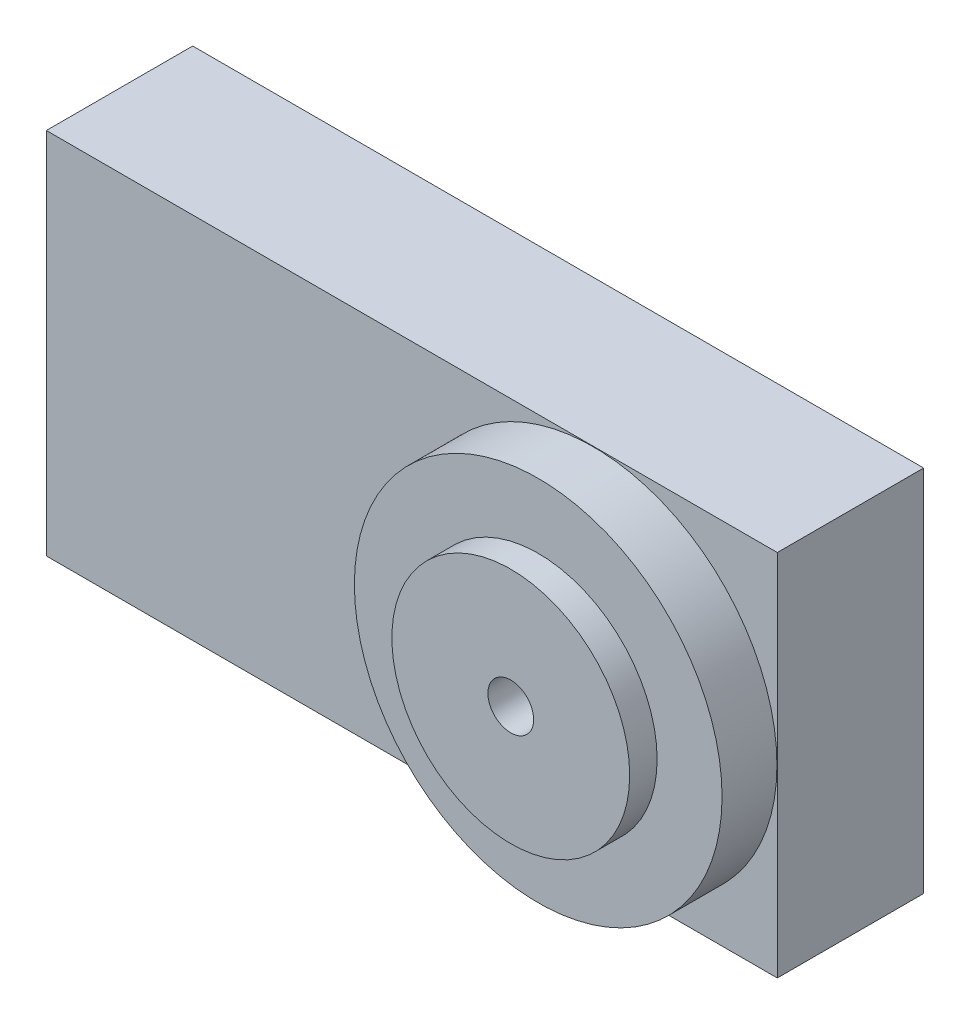
from build123d import *

# Parameters (mm, degrees)
SKETCH1_W           = 39.958127878
SKETCH1_H           = 20.143584626
BOSS_EXTRUDE1_DEPTH = 8
SKETCH2_R           = 10.049780621
BOSS_EXTRUDE2_DEPTH = 3
SKETCH3_R           = 6.5
BOSS_EXTRUDE3_DEPTH = 1.5
SKETCH4_R           = 1.25
CUT_EXTRUDE1_DEPTH  = 5


with BuildPart() as part:
    # Sketch1 → Boss-Extrude1 (new body)
    with BuildSketch(Plane.XY):
        with Locations((25.688484617, -116.024886289)):
            Rectangle(SKETCH1_W, SKETCH1_H)
    extrude(amount=BOSS_EXTRUDE1_DEPTH)

    # Sketch2 → Boss-Extrude2 (add)
    with BuildSketch(Plane.XY.offset(8)):
        with Locations((35.597548556, -116.024886289)):
            Circle(SKETCH2_R)
    extrude(amount=BOSS_EXTRUDE2_DEPTH)

    # Sketch3 → Boss-Extrude3 (add)
    with BuildSketch(Plane.XY.offset(11)):
        with Locations((35.597548556, -116.024886289)):
            Circle(SKETCH3_R)
    extrude(amount=BOSS_EXTRUDE3_DEPTH)

    # Sketch4 → Cut-Extrude1 (cut)
    with BuildSketch(Plane.XY.offset(12.5)):
        with Locations((35.597548556, -116.024886289)):
            Circle(SKETCH4_R)
    extrude(amount=-CUT_EXTRUDE1_DEPTH, mode=Mode.SUBTRACT)


solid = part.part
